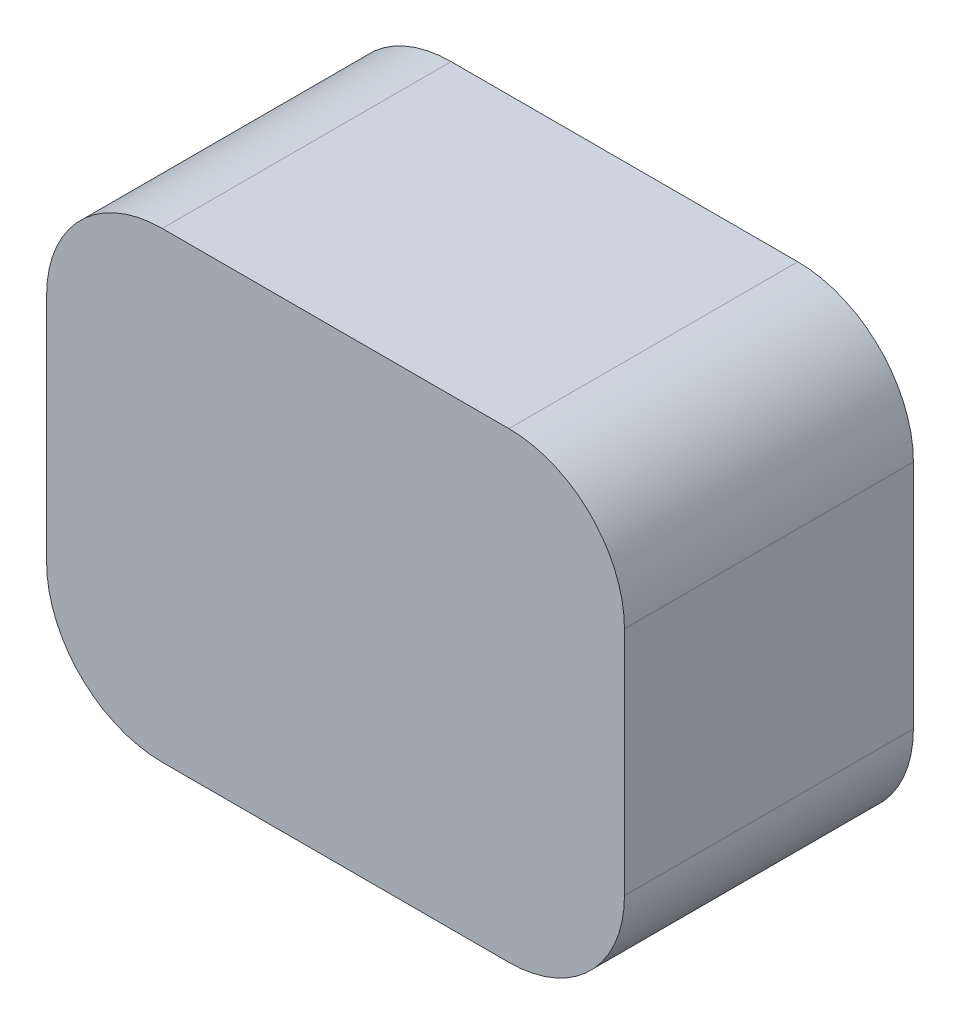
from build123d import *

# Parameters (mm, degrees)
SALIENTE_EXTRUIR1_DEPTH = 10


with BuildPart() as part:
    # Croquis1 → Saliente-Extruir1 (new body)
    with BuildSketch(Plane.XY):
        with BuildLine():
            Line((-23.307904905, 36.779313731), (-11.307904905, 36.779313731))
            ThreePointArc((-11.307904905, 36.779313731), (-8.479477781, 35.607740856), (-7.307904905, 32.779313731))
            Line((-7.307904905, 32.779313731), (-7.307904905, 24.779313731))
            ThreePointArc((-7.307904905, 24.779313731), (-8.479477781, 21.950886607), (-11.307904905, 20.779313731))
            Line((-11.307904905, 20.779313731), (-23.307904905, 20.779313731))
            ThreePointArc((-23.307904905, 20.779313731), (-26.13633203, 21.950886607), (-27.307904905, 24.779313731))
            Line((-27.307904905, 24.779313731), (-27.307904905, 32.779313731))
            ThreePointArc((-27.307904905, 32.779313731), (-26.13633203, 35.607740856), (-23.307904905, 36.779313731))
        make_face()
    extrude(amount=SALIENTE_EXTRUIR1_DEPTH)


solid = part.part
